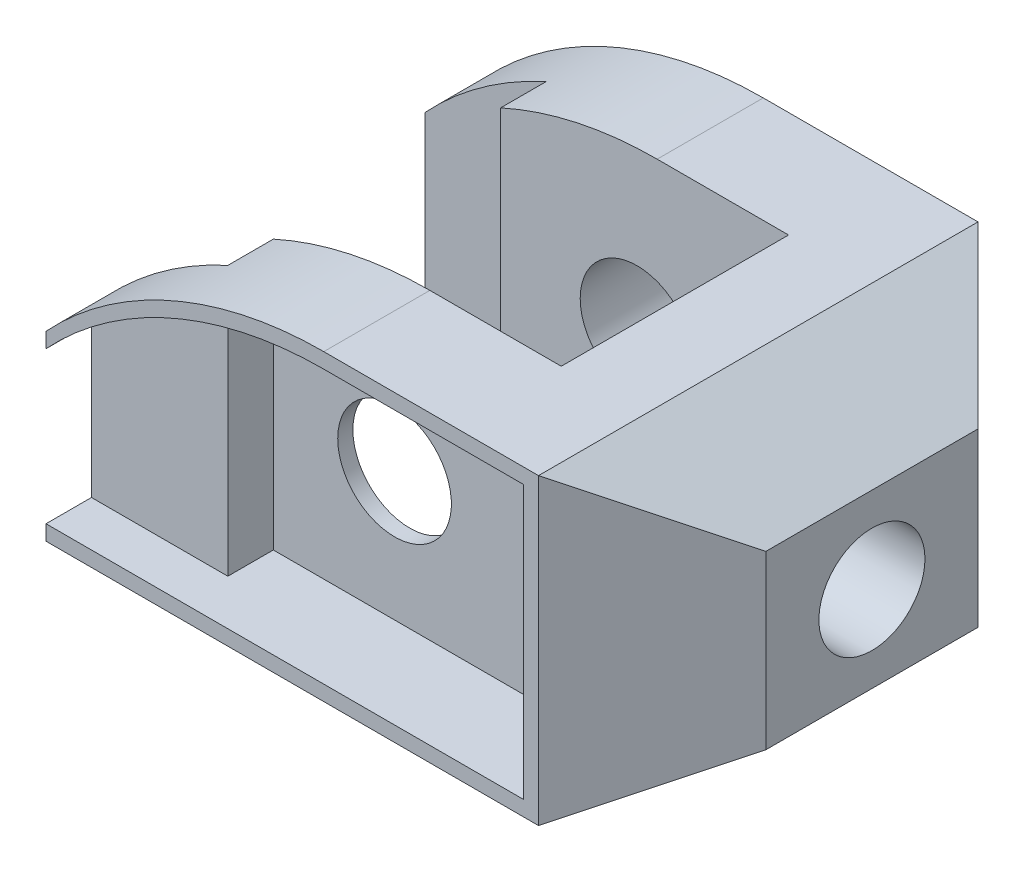
from build123d import *

# Parameters (mm, degrees)
SKETCH1_R           = 7.5
BOSS_EXTRUDE1_DEPTH = 58
CUT_EXTRUDE2_DEPTH  = 58
SKETCH3_R           = 7
CUT_EXTRUDE3_DEPTH  = 58
CUT_EXTRUDE5_DEPTH  = 6
CUT_EXTRUDE7_DEPTH  = 6


with BuildPart() as part:
    # Sketch1 → Boss-Extrude1 (new body)
    with BuildSketch(Plane.XY):
        with BuildLine():
            Line((0, 0), (0, 24))
            ThreePointArc((0, 24), (16.66060556, 35.82575695), (36.66060556, 40))
            Line((36.66060556, 40), (65, 40))
            Line((65, 40), (80, 31.339745962))
            Line((80, 31.339745962), (80, 8.660254038))
            Line((80, 8.660254038), (65, 0))
            Line((65, 0), (0, 0))
        make_face()
        with Locations(Location((34, 19, 0), (0, 0, 180))):
            Circle(SKETCH1_R, mode=Mode.SUBTRACT)
    extrude(amount=BOSS_EXTRUDE1_DEPTH)

    # Sketch2 → Cut-Extrude2 (cut)
    with BuildSketch(Plane(origin=(0, 0, 0), x_dir=(-1, 0, 0), z_dir=(0, -1, 0))):
        Polygon((0, -50), (0, -8), (-16, -8), (-16, -14), (-54, -14), (-54, -44), (-16, -44), (-16, -50), align=None)
        Polygon((-65, -58), (-80, -43), (-80, -58), align=None)
        Polygon((-65, 0), (-80, -15), (-80, 0), align=None)
    extrude(amount=-CUT_EXTRUDE2_DEPTH, mode=Mode.SUBTRACT)

    # Sketch3 → Cut-Extrude3 (cut)
    with BuildSketch(Plane(origin=(80, 0, 0), x_dir=(0, 0, -1), z_dir=(1, 0, 0))):
        with Locations((-29, 20)):
            Circle(SKETCH3_R)
    extrude(amount=-CUT_EXTRUDE3_DEPTH, mode=Mode.SUBTRACT)

    # Sketch4 → Cut-Extrude5 (cut)
    with BuildSketch(Plane.XY.offset(58)):
        with BuildLine():
            Line((0, 22), (0, 2))
            Line((0, 2), (63, 2))
            Line((63, 2), (63, 38))
            Line((63, 38), (36.66060556, 38))
            ThreePointArc((36.66060556, 38), (16.66060556, 33.82575695), (0, 22))
        make_face()
    extrude(amount=-CUT_EXTRUDE5_DEPTH, mode=Mode.SUBTRACT)

    # Sketch6 → Cut-Extrude7 (cut)
    with BuildSketch(Plane.XY.offset(52)):
        with BuildLine():
            Line((63, 38), (63, 2))
            Line((63, 2), (18, 2))
            Line((18, 2), (18, 34.387302143))
            ThreePointArc((18, 34.387302143), (27.157056411, 37.088517533), (36.66060556, 38))
            Line((36.66060556, 38), (63, 38))
        make_face()
    extrude(amount=-CUT_EXTRUDE7_DEPTH, mode=Mode.SUBTRACT)


solid = part.part
